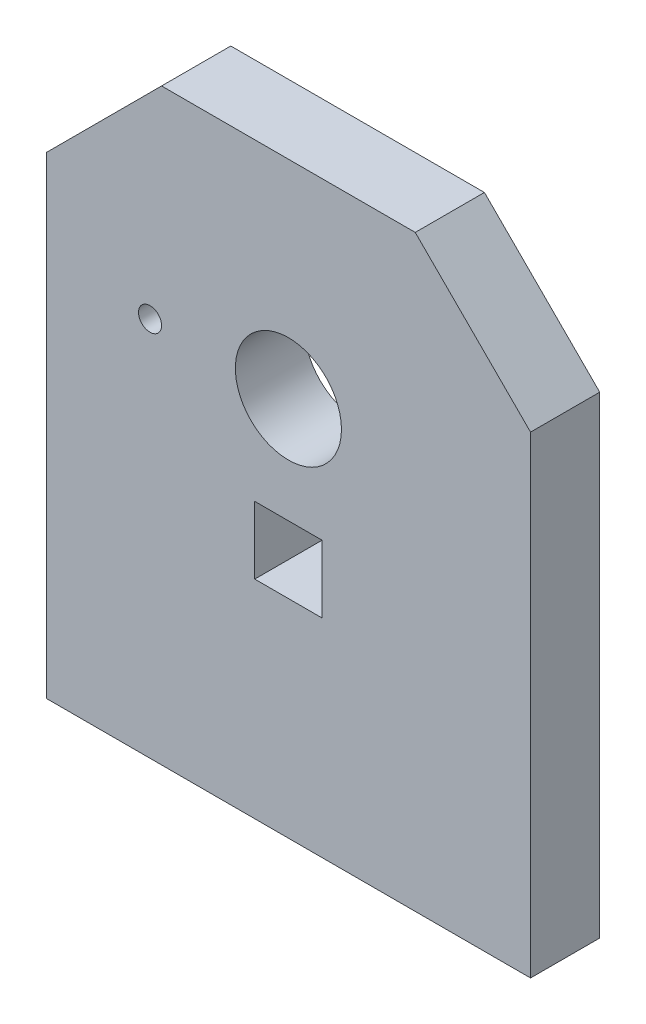
from build123d import *

# Parameters (mm, degrees)
SKETCH1_W           = 2.92
SKETCH1_H           = 2.92
SKETCH1_R           = 0.5
SKETCH1_R_2         = 2.3
BOSS_EXTRUDE1_DEPTH = 3


with BuildPart() as part:
    # Sketch1 → Boss-Extrude1 (new body)
    with BuildSketch(Plane.XY):
        Polygon((13.5482559, 6.709731544), (8.5482559, 11.709731544), (-2.4517441, 11.709731544), (-7.4517441, 6.709731544), (-7.4517441, -13.790268456), (13.5482559, -13.790268456), align=None)
        with Locations((3.0482559, -3.330268456)):
            Rectangle(SKETCH1_W, SKETCH1_H, mode=Mode.SUBTRACT)
        with Locations((-2.9517441, 2.709731544)):
            Circle(SKETCH1_R, mode=Mode.SUBTRACT)
        with Locations((3.0482559, 2.709731544)):
            Circle(SKETCH1_R_2, mode=Mode.SUBTRACT)
    extrude(amount=BOSS_EXTRUDE1_DEPTH)


solid = part.part
